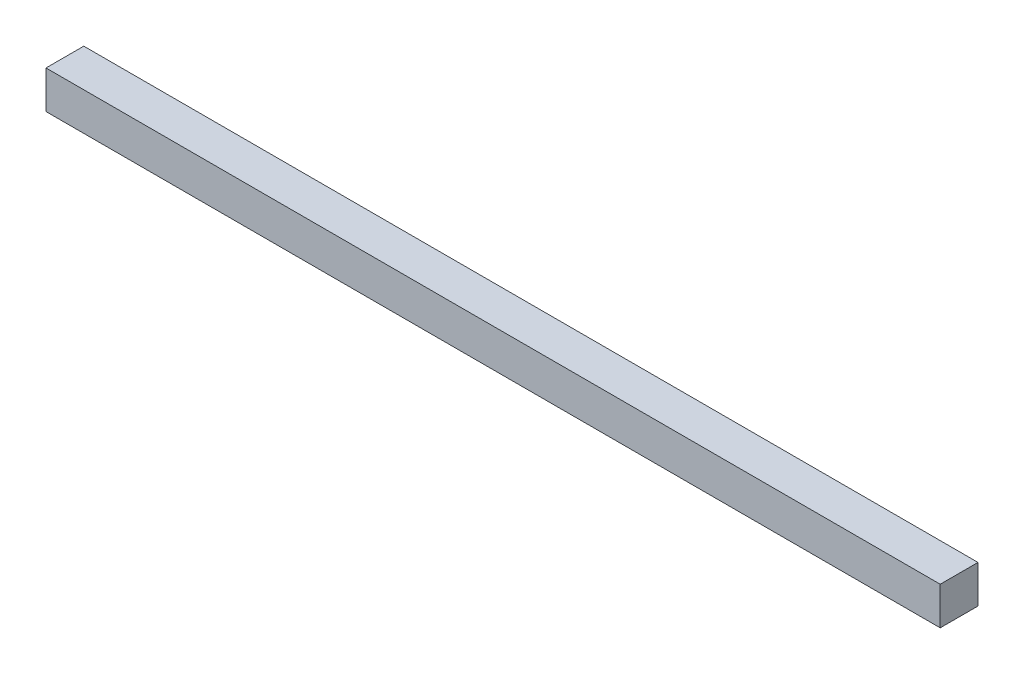
from build123d import *

# Parameters (mm, degrees)
SKETCH1_W     = 142
SKETCH1_H     = 6
PROFILE_DEPTH = 6


with BuildPart() as part:
    # Sketch1 → Profile (new body)
    with BuildSketch(Plane.XY):
        with Locations((71, 3)):
            Rectangle(SKETCH1_W, SKETCH1_H)
    extrude(amount=PROFILE_DEPTH)


solid = part.part
